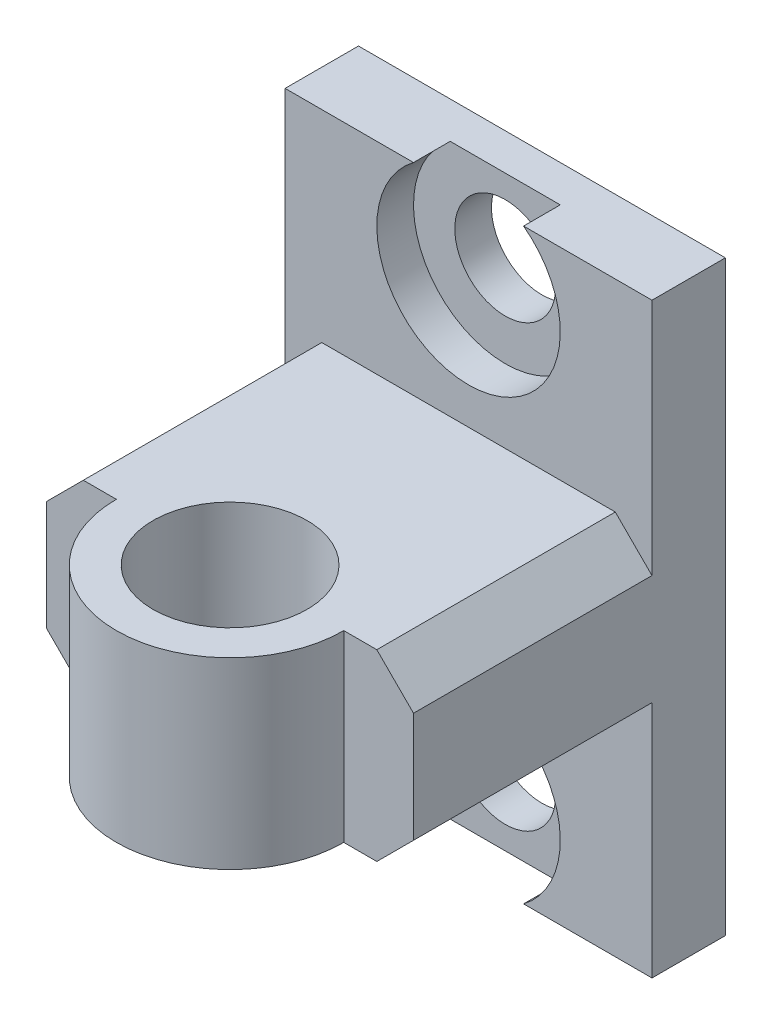
from build123d import *

# Parameters (mm, degrees)
SKETCH_1_W          = 20
SKETCH_1_H          = 32
SKETCH_1_R          = 2.75
EXTRUDE_1_DEPTH     = 4
SKETCH_2_W          = 20
SKETCH_2_H          = 10
EXTRUDE_2_DEPTH     = 13
SKETCH_4_R          = 6.2
EXTRUDE_3_DEPTH     = 10
SKETCH_5_R          = 4.2
CUT_EXTRUDE_1_DEPTH = 13
CHAMFER_1_SIZE      = 2
SKETCH_6_R          = 5
CUT_EXTRUDE_2_DEPTH = 2


with BuildPart() as part:
    # 草图1 → 凸台-拉伸1 (new body)
    with BuildSketch(Plane.XY):
        with Locations((10, -16)):
            Rectangle(SKETCH_1_W, SKETCH_1_H)
        with Locations((10, -4)):
            Circle(SKETCH_1_R, mode=Mode.SUBTRACT)
        with Locations((10, -28)):
            Circle(SKETCH_1_R, mode=Mode.SUBTRACT)
    extrude(amount=EXTRUDE_1_DEPTH)

    # 草图2 → 凸台-拉伸2 (add)
    with BuildSketch(Plane.XY.offset(4)):
        with Locations((10, -16)):
            Rectangle(SKETCH_2_W, SKETCH_2_H)
    extrude(amount=EXTRUDE_2_DEPTH)

    # 草图4 → 凸台-拉伸3 (add)
    with BuildSketch(Plane.XZ.offset(21)):
        with Locations((10, 17)):
            Circle(SKETCH_4_R)
    extrude(amount=-EXTRUDE_3_DEPTH)

    # 草图5 → 切除-拉伸1 (cut)
    with BuildSketch(Plane(origin=(0, -11, 0), x_dir=(1, 0, 0), z_dir=(0, 1, 0))):
        with Locations(Location((10, -17, 0), (0, 0, 270))):
            Circle(SKETCH_5_R)
    extrude(amount=-CUT_EXTRUDE_1_DEPTH, mode=Mode.SUBTRACT)

    # 倒角1
    chamfer_1_edges = [part.edges().sort_by_distance(p)[0] for p in [
        (0, -11, 10.5),
        (0, -21, 10.5),
        (20, -21, 10.5),
        (20, -11, 10.5),
    ]]
    chamfer(chamfer_1_edges, length=CHAMFER_1_SIZE)

    # 草图6 → 切除-拉伸2 (cut)
    with BuildSketch(Plane.XY.offset(4)):
        with Locations((10, -28)):
            Circle(SKETCH_6_R)
        with Locations((10, -4)):
            Circle(SKETCH_6_R)
    extrude(amount=-CUT_EXTRUDE_2_DEPTH, mode=Mode.SUBTRACT)


solid = part.part
